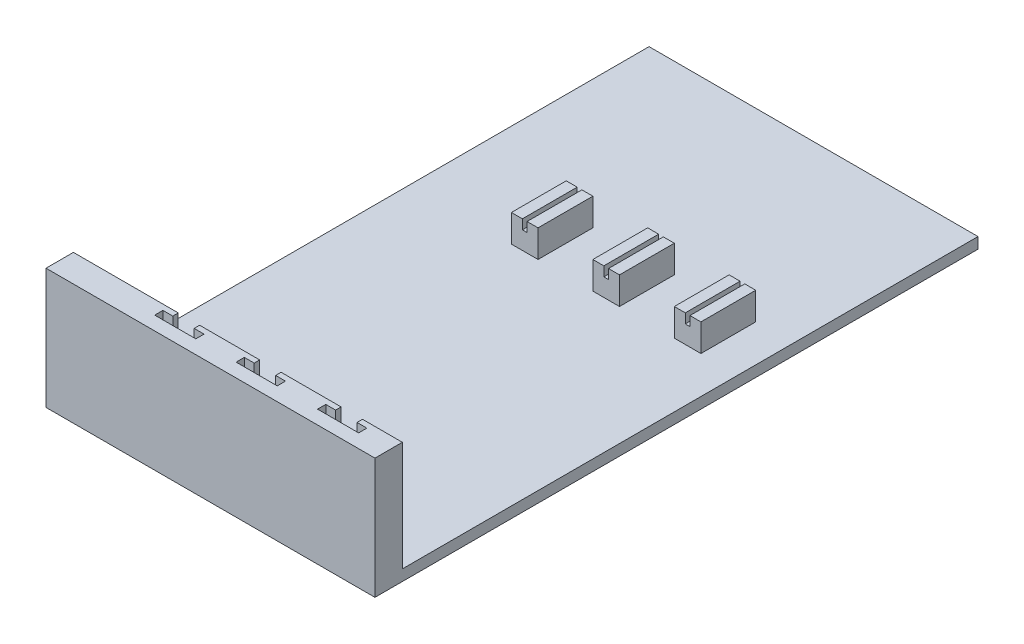
from build123d import *

# Parameters (mm, degrees)
SKETCH1_W           = 120
SKETCH1_H           = 220
BOSS_EXTRUDE1_DEPTH = 4
SKETCH2_W           = 120
SKETCH2_H           = 10
BOSS_EXTRUDE2_DEPTH = 40
CUT_EXTRUDE1_START  = -33.5
CUT_EXTRUDE1_DEPTH  = 33.5
BOSS_EXTRUDE3_DEPTH = 20


with BuildPart() as part:
    # Sketch1 → Boss-Extrude1 (new body)
    with BuildSketch(Plane(origin=(0, 0, 0), x_dir=(1, 0, 0), z_dir=(0, 1, 0))):
        Rectangle(SKETCH1_W, SKETCH1_H)
    extrude(amount=BOSS_EXTRUDE1_DEPTH)

    # Sketch2 → Boss-Extrude2 (add)
    with BuildSketch(Plane(origin=(0, 4, 0), x_dir=(1, 0, 0), z_dir=(0, 1, 0))):
        with Locations((0, -105)):
            Rectangle(SKETCH2_W, SKETCH2_H)
    extrude(amount=BOSS_EXTRUDE2_DEPTH)

    # Sketch4 → Cut-Extrude1 (cut)
    with BuildSketch(Plane(origin=(0, 44, 0), x_dir=(1, 0, 0), z_dir=(0, 1, 0)).offset(CUT_EXTRUDE1_START)):
        Polygon((49.06548636, -105), (49.06548636, -102), (45.46548636, -102), (45.46548636, -92), (37.66548636, -92), (37.66548636, -102), (34.06548636, -102), (34.06548636, -105), align=None)
        Polygon((19.35516212, -105), (19.35516212, -102), (15.75516212, -102), (15.75516212, -92), (7.95516212, -92), (7.95516212, -102), (4.35516212, -102), (4.35516212, -105), align=None)
        Polygon((-10.35516212, -105), (-10.35516212, -102), (-13.95516212, -102), (-13.95516212, -92), (-21.75516212, -92), (-21.75516212, -102), (-25.35516212, -102), (-25.35516212, -105), align=None)
    extrude(amount=CUT_EXTRUDE1_DEPTH, mode=Mode.SUBTRACT)

    # Sketch5 → Boss-Extrude3 (add)
    with BuildSketch(Plane(origin=(0, 0, -42.5), x_dir=(-1, 0, 0), z_dir=(0, 0, -1))):
        Polygon((-46.42064848, 4), (-36.71032424, 4), (-36.71032424, 14), (-40.71032424, 14), (-40.71032424, 10.5), (-42.42064848, 10.5), (-42.42064848, 14), (-46.42064848, 14), align=None)
        Polygon((-16.71032424, 4), (-16.71032424, 14), (-12.71032424, 14), (-12.71032424, 10.5), (-11, 10.5), (-11, 14), (-7, 14), (-7, 4), align=None)
        Polygon((13, 4), (13, 14), (17, 14), (17, 10.5), (18.71032424, 10.5), (18.71032424, 14), (22.71032424, 14), (22.71032424, 4), align=None)
    extrude(amount=-BOSS_EXTRUDE3_DEPTH)


solid = part.part
